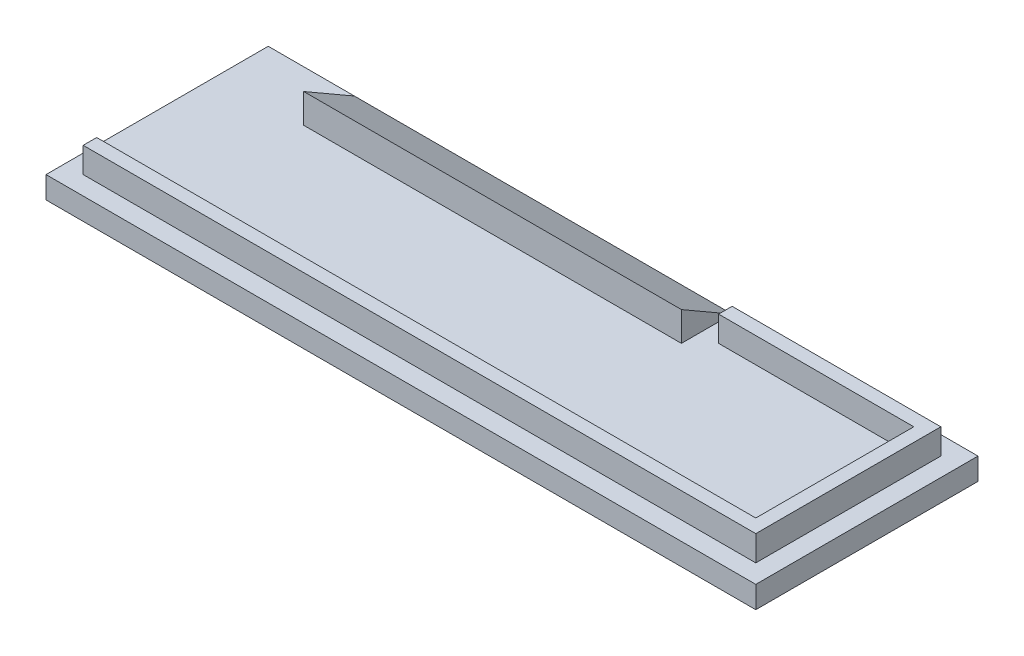
from build123d import *

# Parameters (mm, degrees)
SKETCH1_W           = 42
SKETCH1_H           = 13.15
BOSS_EXTRUDE1_DEPTH = 1.3
BOSS_EXTRUDE3_START = -5.1
BOSS_EXTRUDE3_DEPTH = 22.35
BOSS_EXTRUDE4_DEPTH = 1.5


with BuildPart() as part:
    # Sketch1 → Boss-Extrude1 (new body)
    with BuildSketch(Plane(origin=(0, 0, 0), x_dir=(1, 0, 0), z_dir=(0, 1, 0))):
        with Locations((21, 6.575)):
            Rectangle(SKETCH1_W, SKETCH1_H)
    extrude(amount=BOSS_EXTRUDE1_DEPTH)

    # Sketch3 → Boss-Extrude3 (add)
    with BuildSketch(Plane.ZY.offset(BOSS_EXTRUDE3_START)):
        Polygon((-13.15, 1.3), (-10.15, 1.3), (-10.15, 3.032050808), align=None)
    extrude(amount=-BOSS_EXTRUDE3_DEPTH)

    # Sketch4 → Boss-Extrude4 (add)
    with BuildSketch(Plane(origin=(0, 1.3, 0), x_dir=(1, 0, 0), z_dir=(0, 1, 0))):
        Polygon((40.9, 1.1), (40.9, 12.05), (28.55, 12.05), (28.55, 11.25), (40.1, 11.25), (40.1, 1.9), (1.1, 1.9), (1.1, 1.1), align=None)
    extrude(amount=BOSS_EXTRUDE4_DEPTH)


solid = part.part
